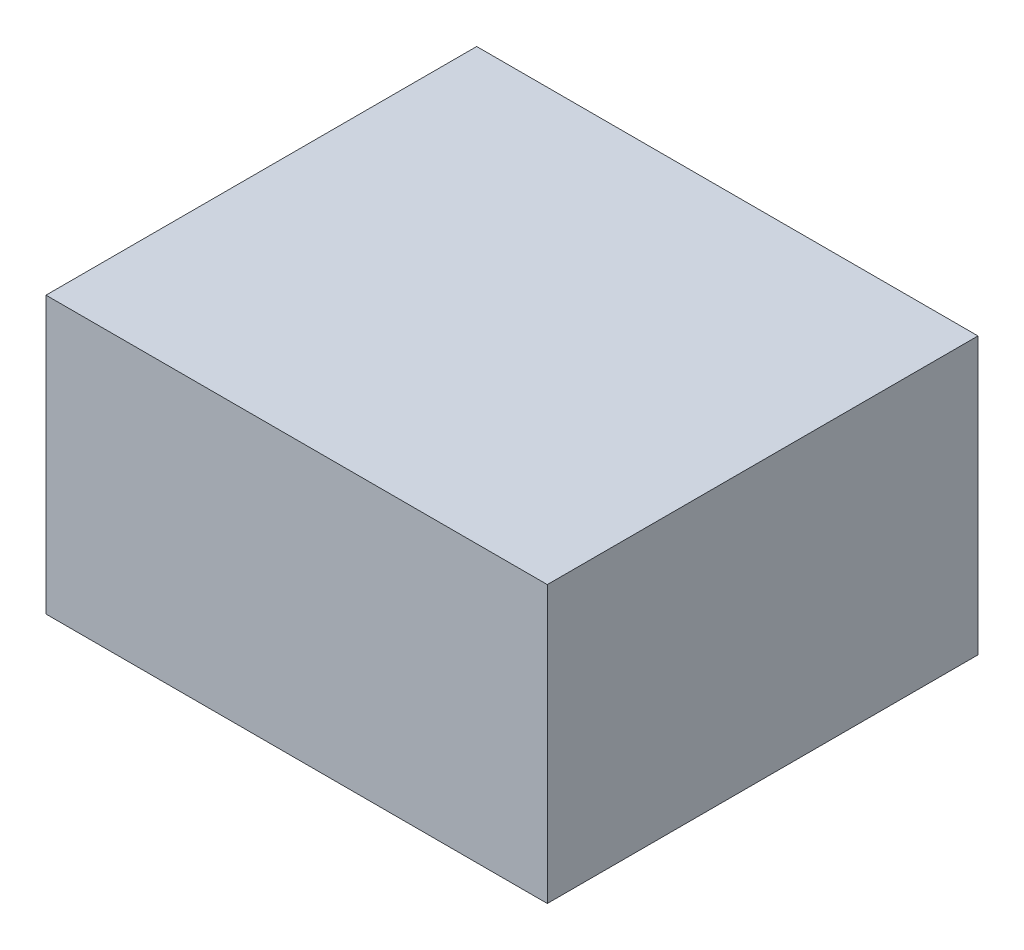
from build123d import *

# Parameters (mm, degrees)
SKETCH1_W           = 145.880200278
SKETCH1_H           = 125.32663254
BOSS_EXTRUDE1_DEPTH = 80.374704292


with BuildPart() as part:
    # Sketch1 → Boss-Extrude1 (new body)
    with BuildSketch(Plane(origin=(0, 0, 0), x_dir=(1, 0, 0), z_dir=(0, 1, 0))):
        Rectangle(SKETCH1_W, SKETCH1_H)
    extrude(amount=BOSS_EXTRUDE1_DEPTH)


solid = part.part
